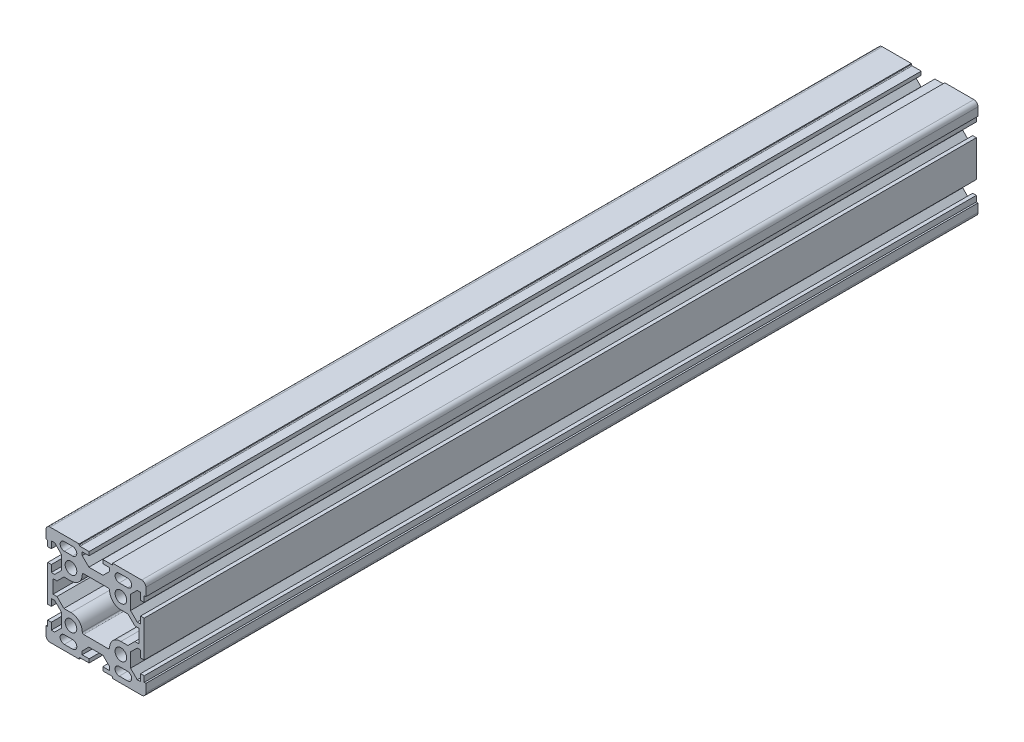
from build123d import *

# Parameters (mm, degrees)
SKETCH_2_R      = 3.5
EXTRUDE_3_DEPTH = 500


with BuildPart() as part:
    # Эскиз2 → Бобышка-Вытянуть3 (new body)
    with BuildSketch(Plane.XY):
        with BuildLine():
            Line((-4.25, 20.8), (4.25, 20.8))
            Line((4.25, 20.8), (8.25, 24.8))
            Line((8.25, 24.8), (8.25, 26.8))
            Line((8.25, 26.8), (4.1, 26.8))
            Line((4.1, 26.8), (4.1, 29))
            Line((4.1, 29), (9.55, 29))
            ThreePointArc((9.55, 29), (9.903553391, 29.146446609), (10.05, 29.5))
            Line((10.05, 29.5), (10.05, 30))
            Line((10.05, 30), (27.5, 30))
            ThreePointArc((27.5, 30), (29.267766953, 29.267766953), (30, 27.5))
            Line((30, 27.5), (30, 22.55))
            Line((30, 22.55), (29, 22.55))
            Line((29, 22.55), (29, 19.1))
            Line((29, 19.1), (26.8, 19.1))
            Line((26.8, 19.1), (26.8, 23.25))
            Line((26.8, 23.25), (24.8, 23.25))
            Line((24.8, 23.25), (20.8, 19.25))
            Line((20.8, 19.25), (20.8, 10.75))
            Line((20.8, 10.75), (24.8, 6.75))
            Line((24.8, 6.75), (26.8, 6.75))
            Line((26.8, 6.75), (26.8, 10.9))
            Line((26.8, 10.9), (29, 10.9))
            Line((29, 10.9), (29, 0))
            Line((29, 0), (25.8, 0))
            Line((25.8, 0), (25.8, 4.05))
            Line((25.8, 4.05), (23.398780669, 4.05))
            Line((23.398780669, 4.05), (19.248780669, 8.2))
            Line((19.248780669, 8.2), (15, 8.2))
            ThreePointArc((15, 8.2), (10.191673888, 10.191673888), (8.2, 15))
            ThreePointArc((8.2, 15), (7.965685425, 15.565685425), (7.4, 15.8))
            Line((7.4, 15.8), (-7.4, 15.8))
            ThreePointArc((-7.4, 15.8), (-7.965685425, 15.565685425), (-8.2, 15))
            ThreePointArc((-8.2, 15), (-10.191673888, 10.191673888), (-15, 8.2))
            Line((-15, 8.2), (-19.248780669, 8.2))
            Line((-19.248780669, 8.2), (-23.398780669, 4.05))
            Line((-23.398780669, 4.05), (-25.8, 4.05))
            Line((-25.8, 4.05), (-25.8, 0))
            Line((-25.8, 0), (-29, 0))
            Line((-29, 0), (-29, 10.9))
            Line((-29, 10.9), (-26.8, 10.9))
            Line((-26.8, 10.9), (-26.8, 6.75))
            Line((-26.8, 6.75), (-24.8, 6.75))
            Line((-24.8, 6.75), (-20.8, 10.75))
            Line((-20.8, 10.75), (-20.8, 19.25))
            Line((-20.8, 19.25), (-24.8, 23.25))
            Line((-24.8, 23.25), (-26.8, 23.25))
            Line((-26.8, 23.25), (-26.8, 19.1))
            Line((-26.8, 19.1), (-29, 19.1))
            Line((-29, 19.1), (-29, 22.55))
            Line((-29, 22.55), (-30, 22.55))
            Line((-30, 22.55), (-30, 27.5))
            ThreePointArc((-30, 27.5), (-29.267766953, 29.267766953), (-27.5, 30))
            Line((-27.5, 30), (-10.05, 30))
            Line((-10.05, 30), (-10.05, 29.5))
            ThreePointArc((-10.05, 29.5), (-9.903553391, 29.146446609), (-9.55, 29))
            Line((-9.55, 29), (-4.1, 29))
            Line((-4.1, 29), (-4.1, 26.8))
            Line((-4.1, 26.8), (-8.25, 26.8))
            Line((-8.25, 26.8), (-8.25, 24.8))
            Line((-8.25, 24.8), (-4.25, 20.8))
        make_face()
        with Locations((15, 15)):
            Circle(SKETCH_2_R, mode=Mode.SUBTRACT)
        with Locations(Location((-15, 15, 0), (0, 0, 180))):
            Circle(SKETCH_2_R, mode=Mode.SUBTRACT)
        with BuildLine():
            Line((14, 26.75), (19, 26.75))
            ThreePointArc((19, 26.75), (21.5, 24.25), (19, 21.75))
            Line((19, 21.75), (14, 21.75))
            ThreePointArc((14, 21.75), (11.5, 24.25), (14, 26.75))
        make_face(mode=Mode.SUBTRACT)
        with BuildLine():
            Line((-14, 21.75), (-19, 21.75))
            ThreePointArc((-19, 21.75), (-21.5, 24.25), (-19, 26.75))
            Line((-19, 26.75), (-14, 26.75))
            ThreePointArc((-14, 26.75), (-11.5, 24.25), (-14, 21.75))
        make_face(mode=Mode.SUBTRACT)
    extrude_3 = extrude(amount=EXTRUDE_3_DEPTH)

    # Зеркальное отражение13: Бобышка-Вытянуть3 across plane
    add(extrude_3.mirror(Plane(origin=(25.8, 0, 500), x_dir=(0, 0, 1), z_dir=(0, 1, 0))))


solid = part.part
